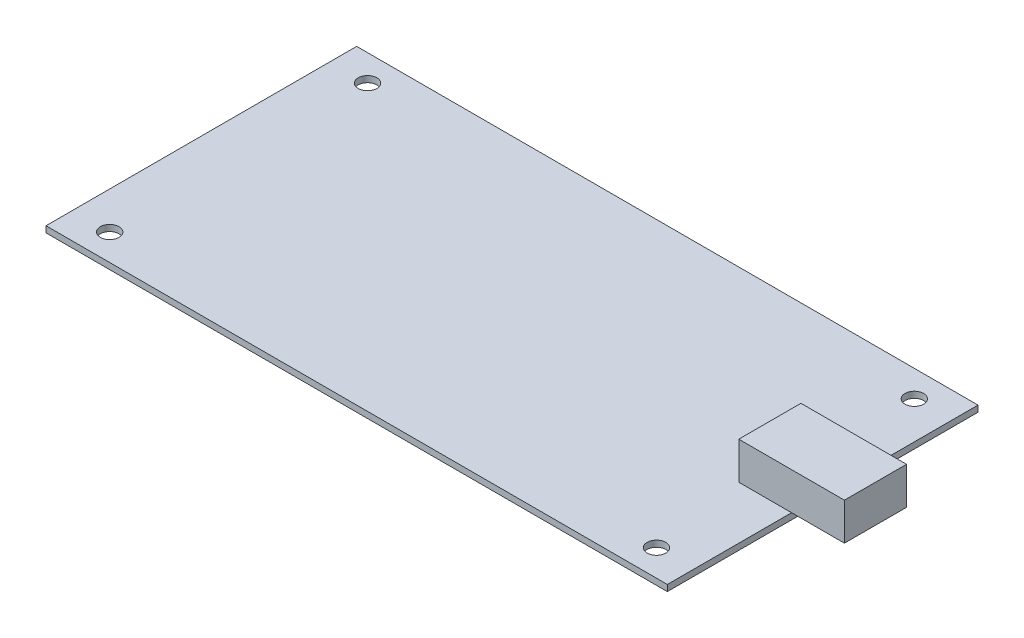
from build123d import *

# Parameters (mm, degrees)
SKETCH_1_W      = 100
SKETCH_1_H      = 50
EXTRUDE_1_DEPTH = 1
SKETCH_2_W      = 17
SKETCH_2_H      = 10
EXTRUDE_2_DEPTH = 6
HOLE_WIZARD_1_D = 3


with BuildPart() as part:
    # 草图1 → 凸台-拉伸1 (new body)
    with BuildSketch(Plane(origin=(0, 0, 0), x_dir=(1, 0, 0), z_dir=(0, 1, 0))):
        Rectangle(SKETCH_1_W, SKETCH_1_H)
    extrude(amount=EXTRUDE_1_DEPTH)

    # 草图2 → 凸台-拉伸2 (add)
    with BuildSketch(Plane(origin=(0, 1, 0), x_dir=(1, 0, 0), z_dir=(0, 1, 0))):
        with Locations((50, 0)):
            Rectangle(SKETCH_2_W, SKETCH_2_H)
    extrude(amount=EXTRUDE_2_DEPTH)

    # 孔1 (through all)
    with Locations(Plane(origin=(0, 1, 0), x_dir=(1, 0, 0), z_dir=(0, 1, 0))):
        with Locations((-44, 20.75), (-44, -20.75), (44, -20.75), (44, 20.75)):
            Hole(HOLE_WIZARD_1_D / 2)


solid = part.part
